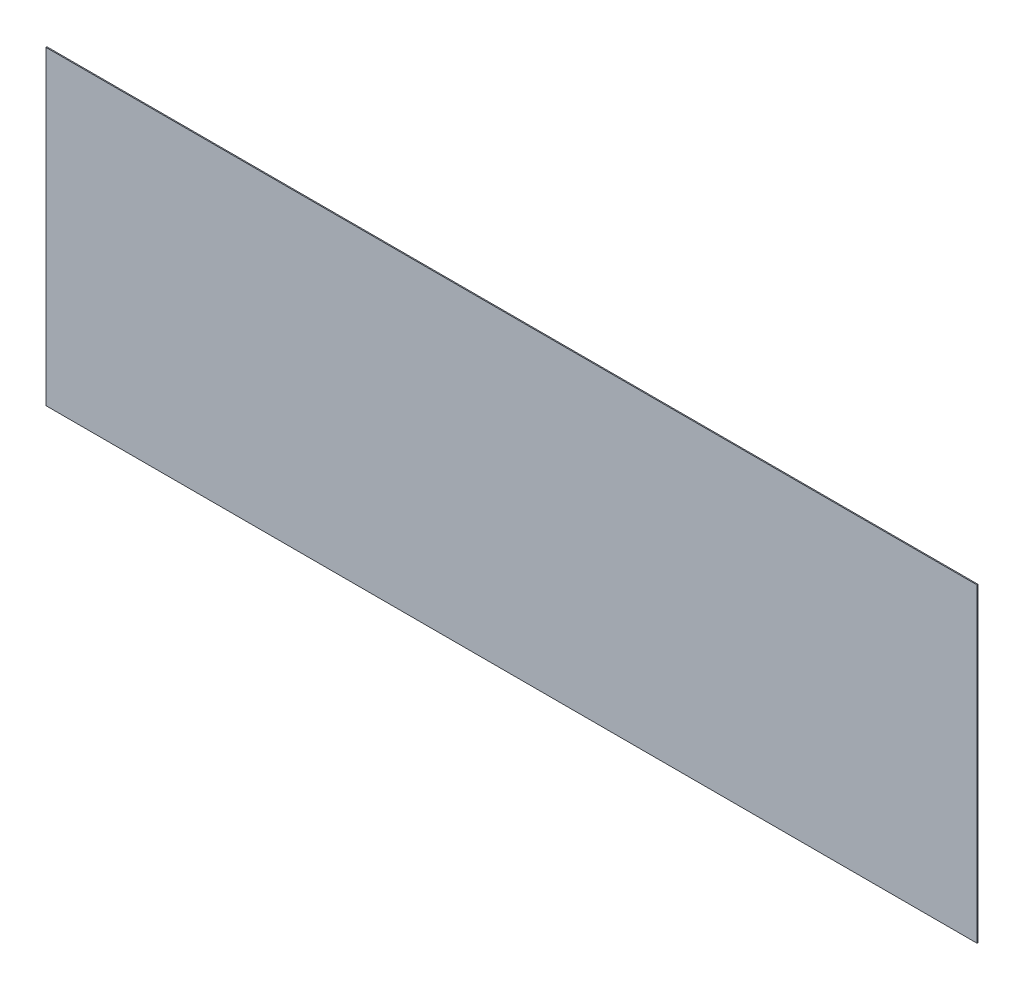
from build123d import *

# Parameters (mm, degrees)
SKETCH1_W           = 450
SKETCH1_H           = 150
BOSS_EXTRUDE1_DEPTH = 0.5


with BuildPart() as part:
    # Sketch1 → Boss-Extrude1 (new body)
    with BuildSketch(Plane.XY):
        with Locations((-12, -321.732722436)):
            Rectangle(SKETCH1_W, SKETCH1_H)
    extrude(amount=BOSS_EXTRUDE1_DEPTH)


solid = part.part
